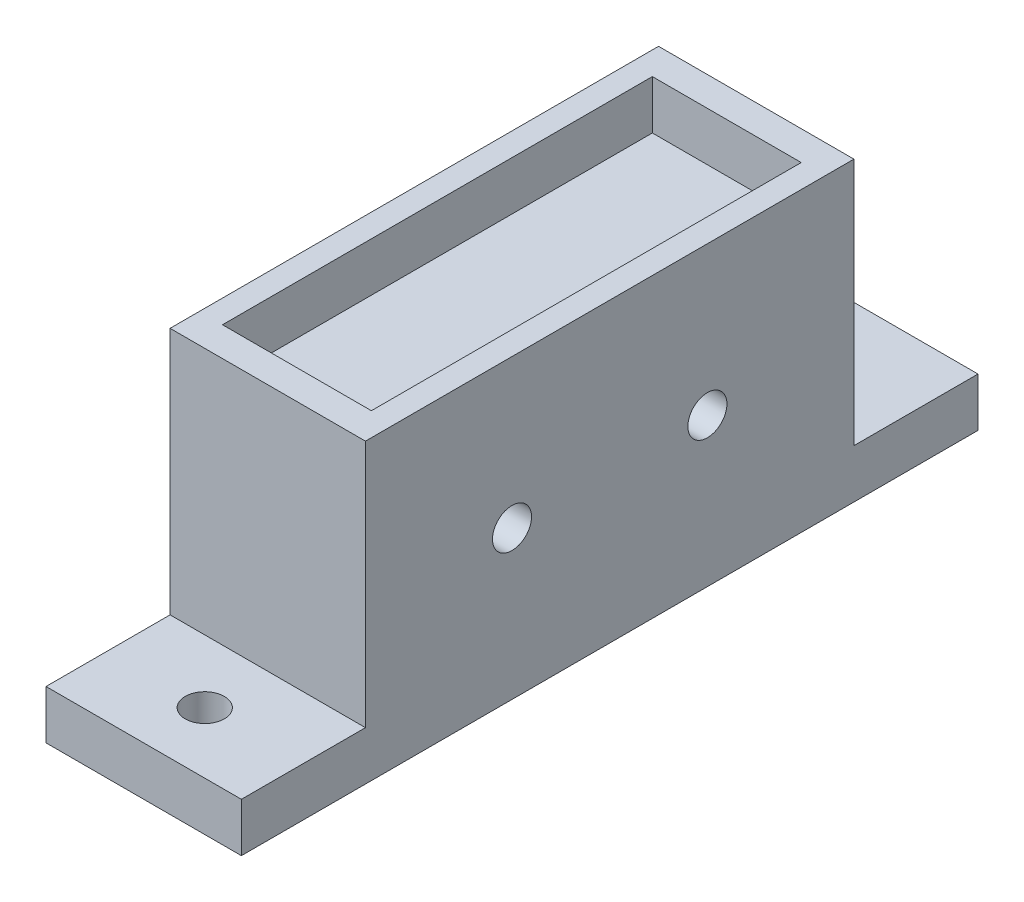
from build123d import *

# Parameters (mm, degrees)
BOSS_EXTRUDE1_DEPTH     = 20
SKETCH4_W               = 15.24
SKETCH4_H               = 44
CUT_EXTRUDE1_DEPTH      = 5
SKETCH5_R               = 2
CUT_EXTRUDE2_DEPTH      = 5
CUT_EXTRUDE3_DEPTH      = 84.72168178
CUT_EXTRUDE3_DEPTH_BACK = 5
SKETCH6_R               = 2


with BuildPart() as part:
    # Sketch1 → Boss-Extrude1 (new body)
    with BuildSketch(Plane(origin=(0, 0, 0), x_dir=(0, 0, -1), z_dir=(1, 0, 0))):
        Polygon((0, 0), (0, 5), (12.7, 5), (12.7, 30.4), (62.7, 30.4), (62.7, 5), (75.4, 5), (75.4, 0), align=None)
    extrude(amount=BOSS_EXTRUDE1_DEPTH)

    # Sketch4 → Cut-Extrude1 (cut)
    with BuildSketch(Plane(origin=(0, 30.4, 0), x_dir=(1, 0, 0), z_dir=(0, 1, 0))):
        with Locations((9.986416009, 37.7)):
            Rectangle(SKETCH4_W, SKETCH4_H)
    extrude(amount=-CUT_EXTRUDE1_DEPTH, mode=Mode.SUBTRACT)

    # Sketch5 → Cut-Extrude2 (cut)
    with BuildSketch(Plane(origin=(0, 5, 0), x_dir=(1, 0, 0), z_dir=(0, 1, 0))):
        with Locations(Location((10, 69.15, 0), (0, 0, 270))):
            Circle(SKETCH5_R)
        with Locations(Location((10, 6.25, 0), (0, 0, 270))):
            Circle(SKETCH5_R)
    extrude(amount=-CUT_EXTRUDE2_DEPTH, mode=Mode.SUBTRACT)

    # Sketch6 → Cut-Extrude3 (cut, two sides: drawn at the far end of the back side and taken through both)
    with BuildSketch(Plane(origin=(0, 0, 0), x_dir=(0, 0, -1), z_dir=(1, 0, 0)).offset(-CUT_EXTRUDE3_DEPTH_BACK)):
        with Locations(Location((27.7, 15.2, 0), (0, 0, 180))):
            Circle(SKETCH6_R)
        with Locations(Location((47.7, 15.2, 0), (0, 0, 180))):
            Circle(SKETCH6_R)
    extrude(amount=CUT_EXTRUDE3_DEPTH + CUT_EXTRUDE3_DEPTH_BACK, mode=Mode.SUBTRACT)


solid = part.part
